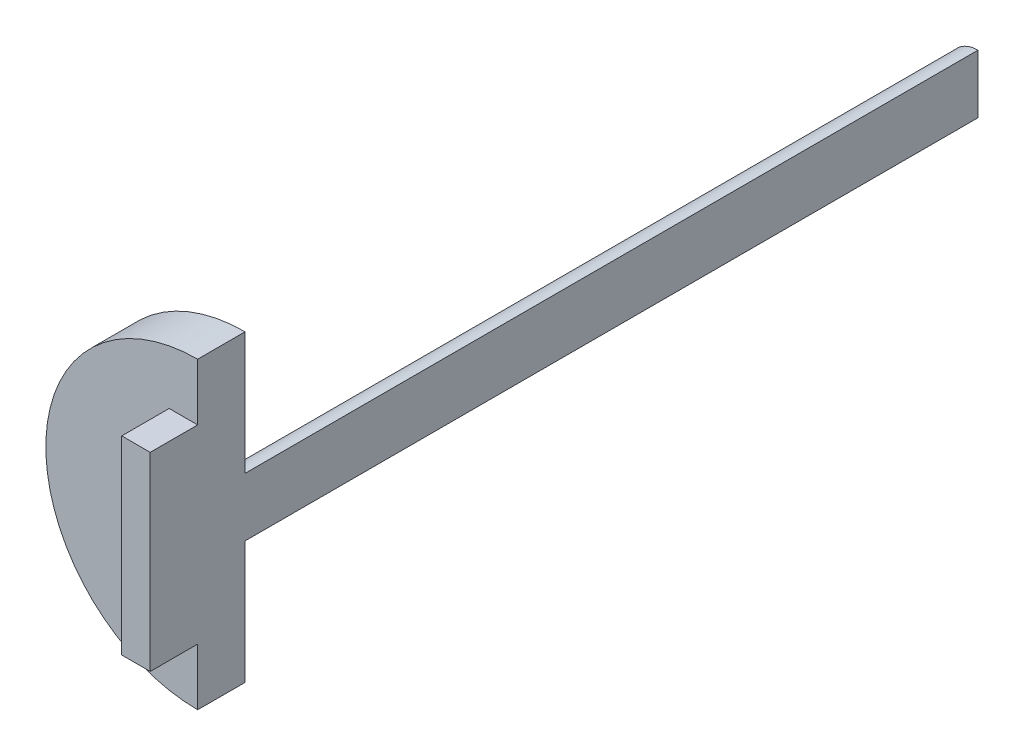
from build123d import *

# Parameters (mm, degrees)
CROQUIS11_R             = 3.085
SALIENTE_EXTRUIR2_DEPTH = 77.23
CROQUIS12_R             = 16
SALIENTE_EXTRUIR3_DEPTH = 5
CROQUIS13_W             = 6
CROQUIS13_H             = 20
SALIENTE_EXTRUIR4_DEPTH = 5
CORTAR_EXTRUIR9_REACH   = 92.117
CROQUIS14_W             = 16
CROQUIS14_H             = 32


with BuildPart() as part:
    # Croquis11 → Saliente-Extruir2 (new body)
    with BuildSketch(Plane.XY):
        Circle(CROQUIS11_R)
    extrude(amount=SALIENTE_EXTRUIR2_DEPTH)

    # Croquis12 → Saliente-Extruir3 (add)
    with BuildSketch(Plane.XY.offset(77.23)):
        Circle(CROQUIS12_R)
    extrude(amount=SALIENTE_EXTRUIR3_DEPTH)

    # Croquis13 → Saliente-Extruir4 (add)
    with BuildSketch(Plane.XY.offset(82.23)):
        Rectangle(CROQUIS13_W, CROQUIS13_H)
    extrude(amount=SALIENTE_EXTRUIR4_DEPTH)

    # Cortar-Extruir9: up to this face of the body (flat: up to its plane)
    cortar_extruir9_end = Plane(part.part.faces().sort_by_distance((0, 0, 0))[0])
    # Croquis14 → Cortar-Extruir9 (cut, up to the picked face)
    with BuildSketch(Plane.XY.offset(87.23), mode=Mode.PRIVATE) as cortar_extruir9_sk1:
        with Locations((8, 0)):
            Rectangle(CROQUIS14_W, CROQUIS14_H)
    cortar_extruir9_tool1 = split(extrude(cortar_extruir9_sk1.sketch, amount=-CORTAR_EXTRUIR9_REACH, mode=Mode.PRIVATE), bisect_by=cortar_extruir9_end, keep=Keep.BOTH, mode=Mode.PRIVATE)
    add(cortar_extruir9_tool1.solids().sort_by(Axis((8, 0, 87.23), (0, 0, -1)))[0], mode=Mode.SUBTRACT)


solid = part.part
